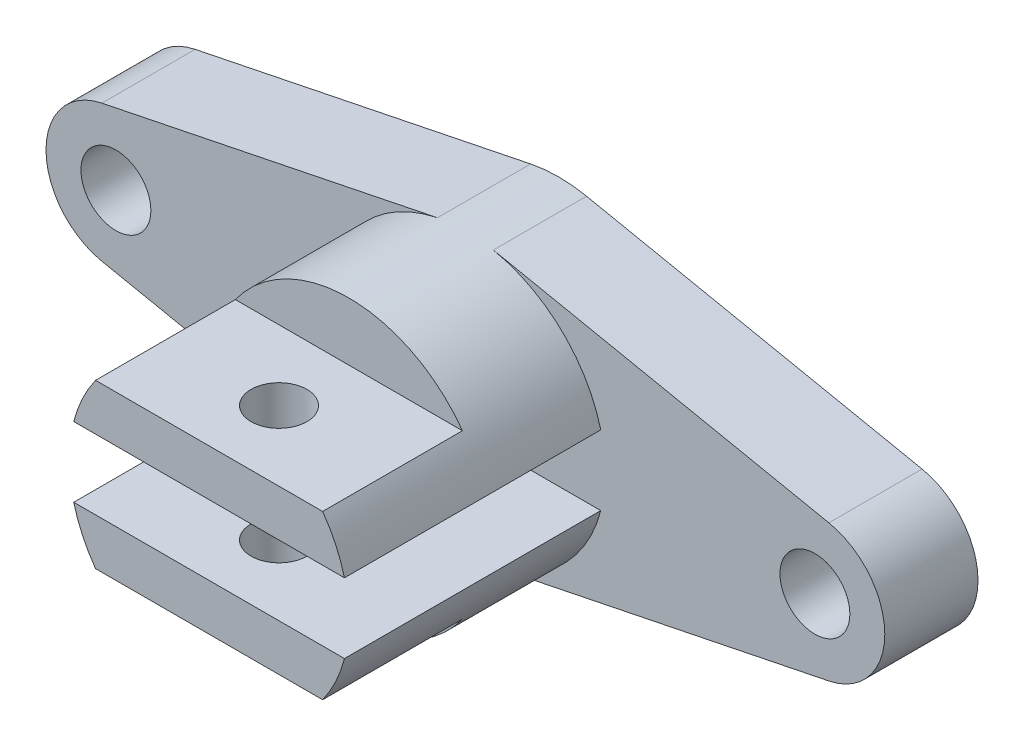
from build123d import *

# Parameters (mm, degrees)
SALIENTE_EXTRUIR1_DEPTH    = 20
CROQUIS9_8_R               = 7.5
CORTAR_EXTRUIR1_DEPTH      = 20
CROQUIS9_10_R              = 7.5
CORTAR_EXTRUIR2_DEPTH      = 20
SALIENTE_EXTRUIR2_DEPTH    = 45
SALIENTE_EXTRUIR3_DEPTH    = 75
CORTAR_EXTRUIR4_DEPTH      = 61
CORTAR_EXTRUIR4_DEPTH_BACK = 52
CROQUIS12_R                = 6


with BuildPart() as part:
    # Croquis9 → Saliente-Extruir1 (new body)
    with BuildSketch(Plane.XY):
        with BuildLine():
            Line((-78, 14.696938457), (-6, 29.393876913))
            ThreePointArc((-6, 29.393876913), (0, 30), (6, 29.393876913))
            Line((6, 29.393876913), (78, 14.696938457))
            ThreePointArc((78, 14.696938457), (90, 0), (78, -14.696938457))
            Line((78, -14.696938457), (6, -29.393876913))
            ThreePointArc((6, -29.393876913), (0, -30), (-6, -29.393876913))
            Line((-6, -29.393876913), (-78, -14.696938457))
            ThreePointArc((-78, -14.696938457), (-90, 0), (-78, 14.696938457))
        make_face()
    extrude(amount=SALIENTE_EXTRUIR1_DEPTH)

    # Croquis9<8> → Cortar-Extruir1 (cut)
    with BuildSketch(Plane.XY):
        with Locations((-75, 0)):
            Circle(CROQUIS9_8_R)
    extrude(amount=CORTAR_EXTRUIR1_DEPTH, mode=Mode.SUBTRACT)

    # Croquis9<10> → Cortar-Extruir2 (cut)
    with BuildSketch(Plane.XY):
        with Locations((75, 0)):
            Circle(CROQUIS9_10_R)
    extrude(amount=CORTAR_EXTRUIR2_DEPTH, mode=Mode.SUBTRACT)

    # Croquis10 → Saliente-Extruir2 (add)
    with BuildSketch(Plane.XY):
        with BuildLine():
            Line((-29.047375097, 7.5), (29.047375097, 7.5))
            ThreePointArc((29.047375097, 7.5), (0, 30), (-29.047375097, 7.5))
        make_face()
        with BuildLine():
            Line((-29.047375097, -7.5), (29.047375097, -7.5))
            ThreePointArc((29.047375097, -7.5), (0, -30), (-29.047375097, -7.5))
        make_face()
    extrude(amount=SALIENTE_EXTRUIR2_DEPTH)

    # Croquis11 → Saliente-Extruir3 (add)
    with BuildSketch(Plane.XY):
        with BuildLine():
            Line((-24.366985862, 17.5), (24.366985862, 17.5))
            ThreePointArc((24.366985862, 17.5), (27.171188586, 12.717173855), (29.047375097, 7.5))
            Line((29.047375097, 7.5), (-29.047375097, 7.5))
            ThreePointArc((-29.047375097, 7.5), (-27.171188586, 12.717173855), (-24.366985862, 17.5))
        make_face()
        with BuildLine():
            Line((-24.366985862, -17.5), (24.366985862, -17.5))
            ThreePointArc((24.366985862, -17.5), (27.171188586, -12.717173855), (29.047375097, -7.5))
            Line((29.047375097, -7.5), (-29.047375097, -7.5))
            ThreePointArc((-29.047375097, -7.5), (-27.171188586, -12.717173855), (-24.366985862, -17.5))
        make_face()
    extrude(amount=SALIENTE_EXTRUIR3_DEPTH)

    # Croquis12 → Cortar-Extruir4 (cut, two sides: drawn at the far end of the back side and taken through both)
    with BuildSketch(Plane(origin=(0, 0, 0), x_dir=(1, 0, 0), z_dir=(0, 1, 0)).offset(-CORTAR_EXTRUIR4_DEPTH_BACK)):
        with Locations((0, -60)):
            Circle(CROQUIS12_R)
    extrude(amount=CORTAR_EXTRUIR4_DEPTH + CORTAR_EXTRUIR4_DEPTH_BACK, mode=Mode.SUBTRACT)


solid = part.part
